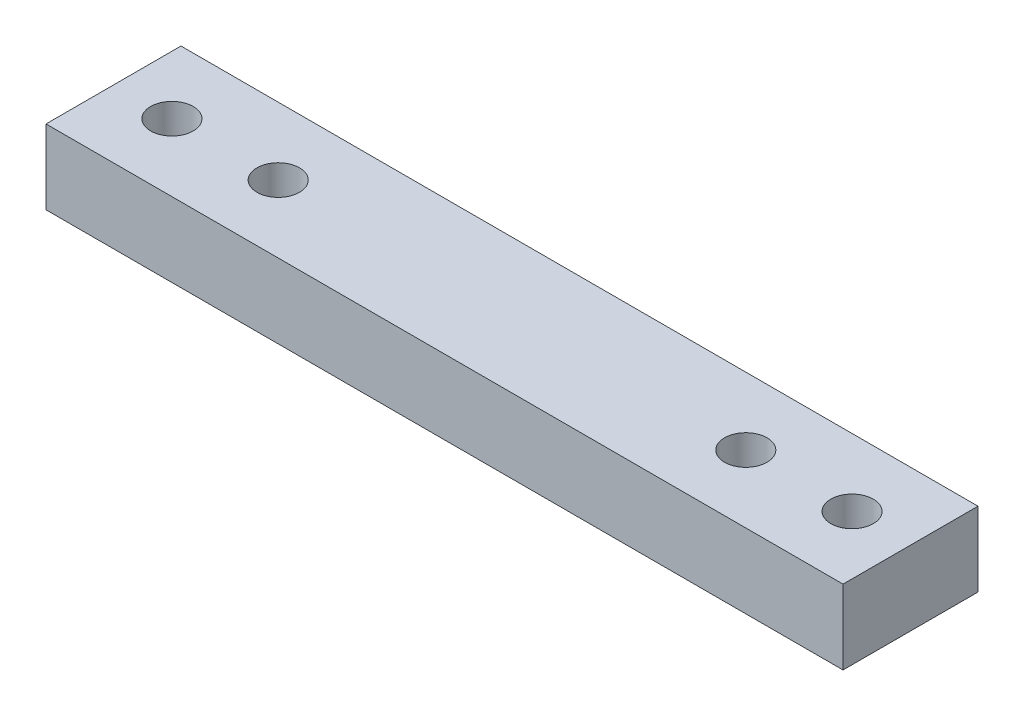
from build123d import *

# Parameters (mm, degrees)
SKETCH_1_W                      = 75
SKETCH_1_H                      = 12.7
SENSOR_ENVELOPE_75X12P7X7_DEPTH = 7
SKETCH_2_R                      = 2
FOUR_M4_NOMINAL_HOLES_DEPTH     = 7


with BuildPart() as part:
    # 草图1 → Sensor_envelope_75x12p7x7 (new body)
    with BuildSketch(Plane(origin=(0, 0, 0), x_dir=(1, 0, 0), z_dir=(0, 1, 0))):
        Rectangle(SKETCH_1_W, SKETCH_1_H)
    extrude(amount=SENSOR_ENVELOPE_75X12P7X7_DEPTH)

    # 草图2 → Four_M4_nominal_holes (cut)
    with BuildSketch(Plane(origin=(0, 0, 0), x_dir=(1, 0, 0), z_dir=(0, 1, 0))):
        with Locations(Location((-32, 0, 0), (0, 0, 270))):
            Circle(SKETCH_2_R)
        with Locations(Location((-22, 0, 0), (0, 0, 270))):
            Circle(SKETCH_2_R)
        with Locations(Location((22, 0, 0), (0, 0, 270))):
            Circle(SKETCH_2_R)
        with Locations(Location((32, 0, 0), (0, 0, 270))):
            Circle(SKETCH_2_R)
    extrude(amount=FOUR_M4_NOMINAL_HOLES_DEPTH, mode=Mode.SUBTRACT)


solid = part.part
